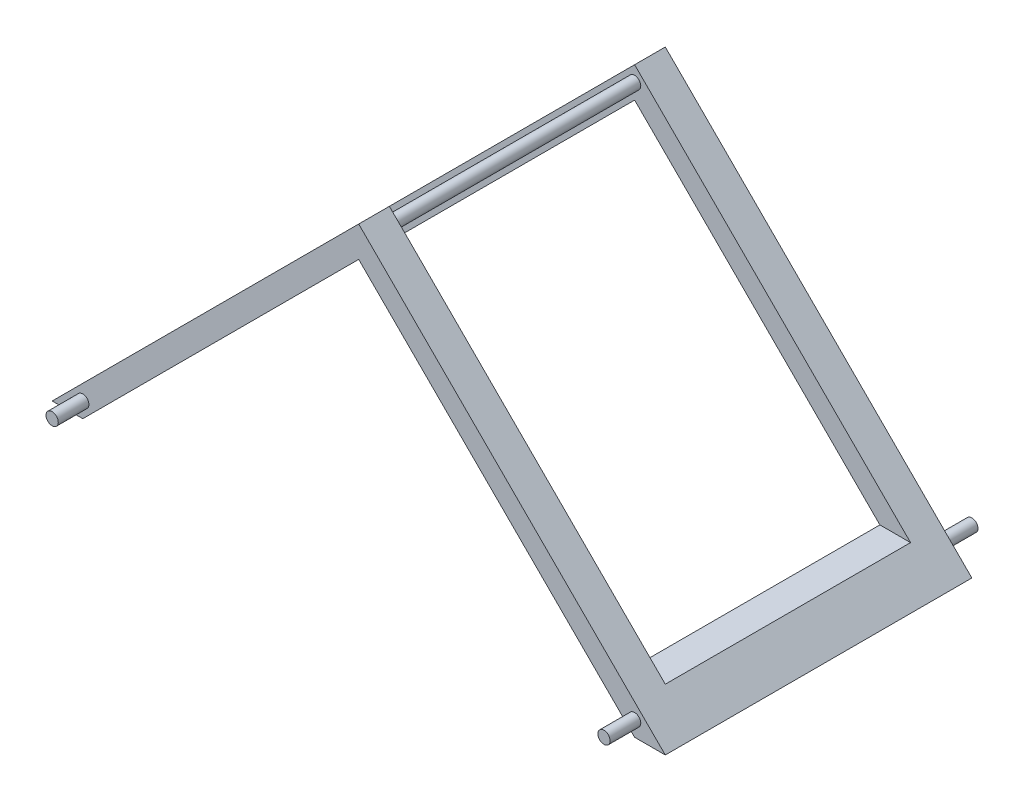
from build123d import *

# Parameters (mm, degrees)
BOSS_EXTRUDE2_DEPTH     = 250
CUT_EXTRUDE1_DEPTH      = 751
CUT_EXTRUDE1_DEPTH_BACK = 751
SKETCH4_W               = 400
SKETCH4_H               = 450
BOSS_EXTRUDE3_REACH     = 840.153
SKETCH6_R               = 10
SKETCH7_R               = 10
BOSS_EXTRUDE4_DEPTH     = 50
MIRROR2_COPY_1_SKETCH_R = 10
MIRROR2_COPY_1_DEPTH    = 50


with BuildPart() as part:
    # Sketch2 → Boss-Extrude2 (new, symmetric)
    with BuildSketch(Plane.XY):
        Polygon((-500, 0), (0, 500), (500, 0), (450, 0), (0, 450), (-450, 0), align=None)
    extrude(amount=BOSS_EXTRUDE2_DEPTH, both=True)

    # Sketch4 → Cut-Extrude1 (cut, two sides: drawn at the far end of the back side and taken through both)
    with BuildSketch(Plane(origin=(0, 0, 0), x_dir=(0, 0, -1), z_dir=(1, 0, 0)).offset(-CUT_EXTRUDE1_DEPTH_BACK)):
        with Locations((0, 275)):
            Rectangle(SKETCH4_W, SKETCH4_H)
    extrude(amount=CUT_EXTRUDE1_DEPTH + CUT_EXTRUDE1_DEPTH_BACK, mode=Mode.SUBTRACT)

    # Sketch6 → Boss-Extrude3 (add, up to next)
    with BuildSketch(Plane(origin=(0, 0, 200), x_dir=(-1, 0, 0), z_dir=(0, 0, -1)), mode=Mode.PRIVATE) as boss_extrude3_sk1:
        with Locations(Location((0, 475, 0), (0, 0, 270))):
            Circle(SKETCH6_R)
    boss_extrude3_tool1 = extrude(boss_extrude3_sk1.sketch, amount=BOSS_EXTRUDE3_REACH, mode=Mode.PRIVATE) - part.part
    add(boss_extrude3_tool1.solids().sort_by_distance((0, 475, 200))[0])

    # Sketch7 → Boss-Extrude4 (add)
    with BuildSketch(Plane.XY.offset(250)):
        with Locations(Location((450, 25, 0), (0, 0, 180))):
            Circle(SKETCH7_R)
    boss_extrude4 = extrude(amount=BOSS_EXTRUDE4_DEPTH)

    # Mirror1: Boss-Extrude4 across plane
    add(boss_extrude4.mirror(Plane.XY))

    # Mirror2: Boss-Extrude4 across plane
    add(boss_extrude4.mirror(Plane(origin=(0, 0, 0), x_dir=(0, 0, 1), z_dir=(1, 0, 0))))

    # Mirror2 copy 1 sketch → Mirror2 copy 1 (add)
    with BuildSketch(Plane(origin=(0, 0, -250), x_dir=(-1, 0, 0), z_dir=(0, 0, -1))):
        with Locations(Location((450, 25, 0), (0, 0, 180))):
            Circle(MIRROR2_COPY_1_SKETCH_R)
    extrude(amount=MIRROR2_COPY_1_DEPTH)


solid = part.part
